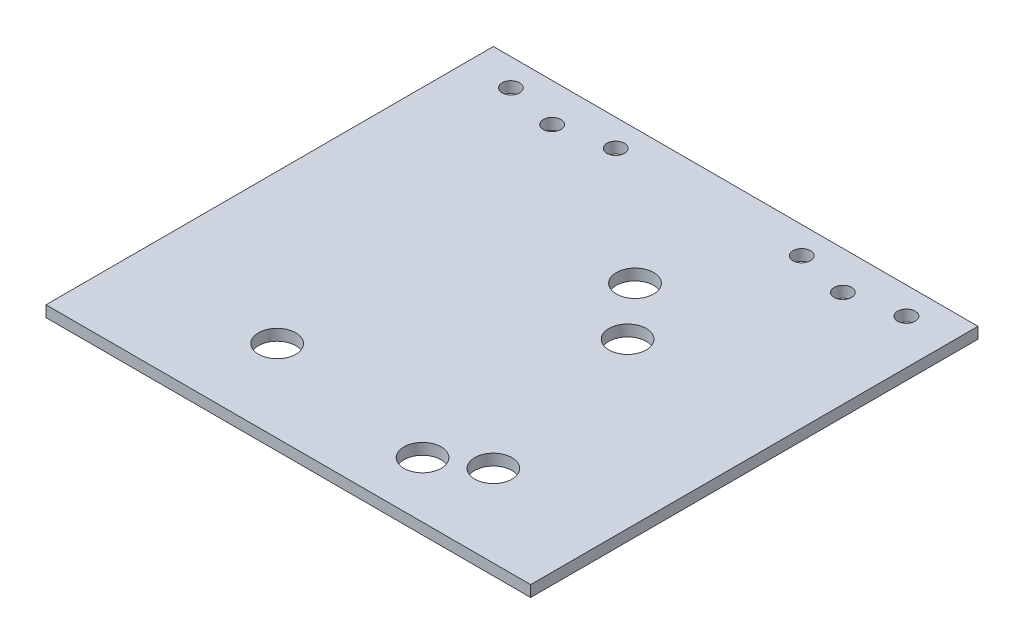
from build123d import *

# Parameters (mm, degrees)
SKETCH1_W                  = 130
SKETCH1_H                  = 150
BOSS_EXTRUDE1_DEPTH        = 3
F_10_0_10_DIAMETER_HOLE2_D = 10
F_14_0_14_DIAMETER_HOLE1_D = 14
F_5_0_5_DIAMETER_HOLE1_D   = 5
F_10_0_10_DIAMETER_HOLE1_D = 10
F_9_0_9_DIAMETER_HOLE1_D   = 9
F_5_0_5_DIAMETER_HOLE2_D   = 5
SKETCH15_W                 = 130
SKETCH15_H                 = 30
CUT_EXTRUDE1_DEPTH         = 199.517001791
SKETCH16_R                 = 2.35
CUT_EXTRUDE2_DEPTH         = 199.517001791


with BuildPart() as part:
    # Sketch1 → Boss-Extrude1 (new body)
    with BuildSketch(Plane(origin=(0, 0, 0), x_dir=(1, 0, 0), z_dir=(0, 1, 0))):
        with Locations((65, -75)):
            Rectangle(SKETCH1_W, SKETCH1_H)
    extrude(amount=BOSS_EXTRUDE1_DEPTH)

    # Ø10.0 (10) Diameter Hole2 (through all)
    with Locations(Plane(origin=(0, 3, 0), x_dir=(1, 0, 0), z_dir=(0, 1, 0))):
        with Locations((40, -128), (98, -128), (74, -66)):
            Hole(F_10_0_10_DIAMETER_HOLE2_D / 2)

    # Ø14.0 (14) Diameter Hole1 (through all)
    with Locations(Plane(origin=(0, 3, 0), x_dir=(1, 0, 0), z_dir=(0, 1, 0))):
        with Locations((16, -16), (114, -16)):
            Hole(F_14_0_14_DIAMETER_HOLE1_D / 2)

    # Ø5.0 (5) Diameter Hole1 (through all)
    with Locations(Plane(origin=(0, 3, 0), x_dir=(1, 0, 0), z_dir=(0, 1, 0))):
        with Locations((4.686291501, -27.313708499), (4.686291501, -4.686291501), (27.313708499, -4.686291501), (27.313708499, -27.313708499), (102.686291501, -27.313708499), (125.313708499, -27.313708499), (125.313708499, -4.686291501), (102.686291501, -4.686291501)):
            Hole(F_5_0_5_DIAMETER_HOLE1_D / 2)

    # Ø10.0 (10) Diameter Hole1 (through all)
    with Locations(Plane(origin=(0, 3, 0), x_dir=(1, 0, 0), z_dir=(0, 1, 0))):
        with Locations((86, -135), (86, -80)):
            Hole(F_10_0_10_DIAMETER_HOLE1_D / 2)

    # Ø9.0 (9) Diameter Hole1 (through all)
    with Locations(Plane(origin=(0, 3, 0), x_dir=(1, 0, 0), z_dir=(0, 1, 0))):
        with Locations((65, -16)):
            Hole(F_9_0_9_DIAMETER_HOLE1_D / 2)

    # Ø5.0 (5) Diameter Hole2 (through all)
    with Locations(Plane(origin=(0, 3, 0), x_dir=(1, 0, 0), z_dir=(0, 1, 0))):
        with Locations((53.686291501, -27.313708499), (76.313708499, -27.313708499), (76.313708499, -4.686291501), (53.686291501, -4.686291501)):
            Hole(F_5_0_5_DIAMETER_HOLE2_D / 2)

    # Sketch15 → Cut-Extrude1 (cut, through all)
    with BuildSketch(Plane(origin=(0, 0, 0), x_dir=(1, 0, 0), z_dir=(0, 1, 0))):
        with Locations((65, -15)):
            Rectangle(SKETCH15_W, SKETCH15_H)
    extrude(amount=CUT_EXTRUDE1_DEPTH, mode=Mode.SUBTRACT)

    # Sketch16 → Cut-Extrude2 (cut, through all)
    with BuildSketch(Plane(origin=(0, 0, 0), x_dir=(1, 0, 0), z_dir=(0, 1, 0))):
        with Locations(Location((89.95, -37.25, 0), (0, 0, 90))):
            Circle(SKETCH16_R)
        with Locations(Location((118.05, -37.25, 0), (0, 0, 90))):
            Circle(SKETCH16_R)
        with Locations(Location((104, -40.25, 0), (0, 0, 90))):
            Circle(SKETCH16_R)
        with Locations(Location((11.95, -37.25, 0), (0, 0, 90))):
            Circle(SKETCH16_R)
        with Locations(Location((40.05, -37.25, 0), (0, 0, 90))):
            Circle(SKETCH16_R)
        with Locations(Location((26, -40.25, 0), (0, 0, 90))):
            Circle(SKETCH16_R)
    extrude(amount=CUT_EXTRUDE2_DEPTH, mode=Mode.SUBTRACT)


solid = part.part
